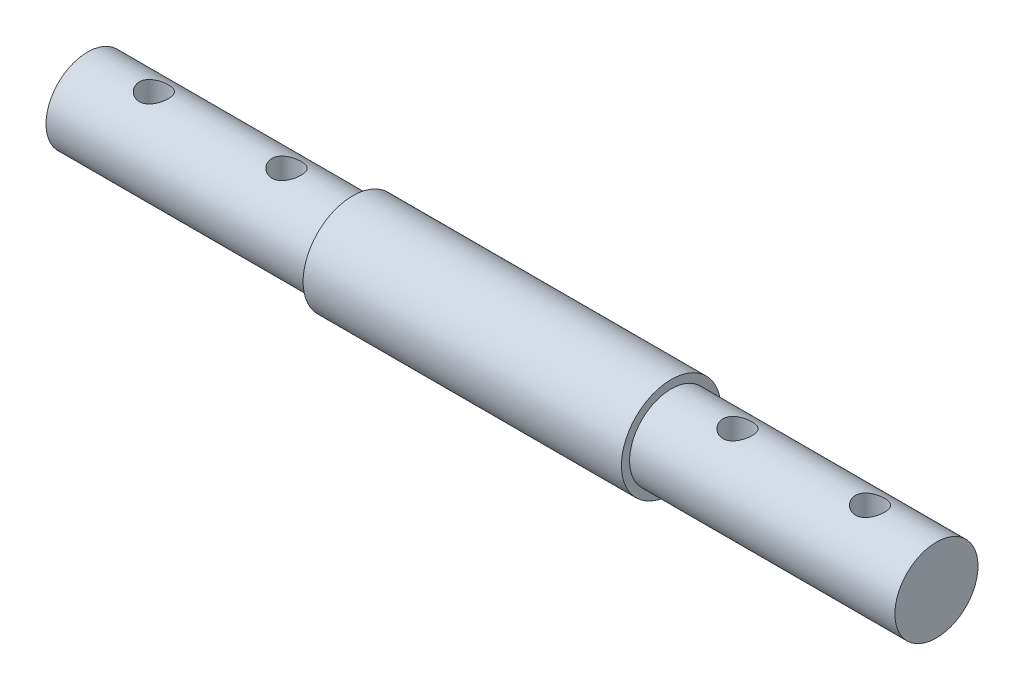
from build123d import *

# Parameters (mm, degrees)
SKETCH1_R               = 37.5
BOSS_EXTRUDE1_DEPTH     = 240
SKETCH2_R               = 31.34
BOSS_EXTRUDE2_DEPTH     = 200
BOSS_EXTRUDE3_START     = 200
SKETCH3_R               = 31.34
BOSS_EXTRUDE3_DEPTH     = 200
CUT_EXTRUDE1_DEPTH      = 444.184498826
CUT_EXTRUDE1_DEPTH_BACK = 444.184498826
SKETCH4_R               = 11


with BuildPart() as part:
    # Sketch1 → Boss-Extrude1 (new body)
    with BuildSketch(Plane(origin=(0, 0, 0), x_dir=(0, 0, -1), z_dir=(1, 0, 0))):
        Circle(SKETCH1_R)
    extrude(amount=BOSS_EXTRUDE1_DEPTH)

    # Sketch2 → Boss-Extrude2 (add)
    with BuildSketch(Plane(origin=(240, 0, 0), x_dir=(0, 0, -1), z_dir=(1, 0, 0))):
        Circle(SKETCH2_R)
    extrude(amount=BOSS_EXTRUDE2_DEPTH)

    # Sketch3 → Boss-Extrude3 (add)
    with BuildSketch(Plane.ZY.offset(BOSS_EXTRUDE3_START)):
        with Locations(Location((0, 0, 0), (0, 0, 180))):
            Circle(SKETCH3_R)
    extrude(amount=-BOSS_EXTRUDE3_DEPTH)

    # Sketch4 → Cut-Extrude1 (cut, two sides: drawn at the far end of the back side and taken through both)
    with BuildSketch(Plane(origin=(0, 0, 0), x_dir=(1, 0, 0), z_dir=(0, 1, 0)).offset(-CUT_EXTRUDE1_DEPTH_BACK)):
        with Locations(Location((-50, 0, 0), (0, 0, 270))):
            Circle(SKETCH4_R)
        with Locations(Location((-150, 0, 0), (0, 0, 270))):
            Circle(SKETCH4_R)
        with Locations(Location((290, 0, 0), (0, 0, 270))):
            Circle(SKETCH4_R)
        with Locations(Location((390, 0, 0), (0, 0, 270))):
            Circle(SKETCH4_R)
    extrude(amount=CUT_EXTRUDE1_DEPTH + CUT_EXTRUDE1_DEPTH_BACK, mode=Mode.SUBTRACT)


solid = part.part
